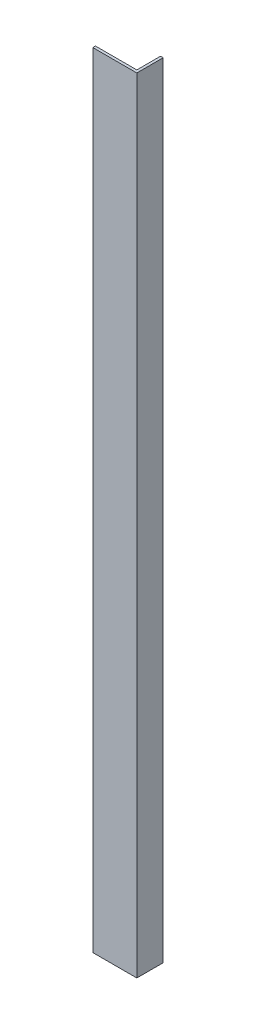
from build123d import *

# Parameters (mm, degrees)
RESSALTO_EXTRUS_O2_DEPTH = 890


with BuildPart() as part:
    # Esboço3 → Ressalto-extrusão2 (new body)
    with BuildSketch(Plane(origin=(0, 0, 0), x_dir=(1, 0, 0), z_dir=(0, 1, 0))):
        Polygon((-25, -12), (-25, -15), (25, -15), (25, 15), (22, 15), (22, 12), (22, -12), (-22, -12), align=None)
    extrude(amount=RESSALTO_EXTRUS_O2_DEPTH)


solid = part.part
